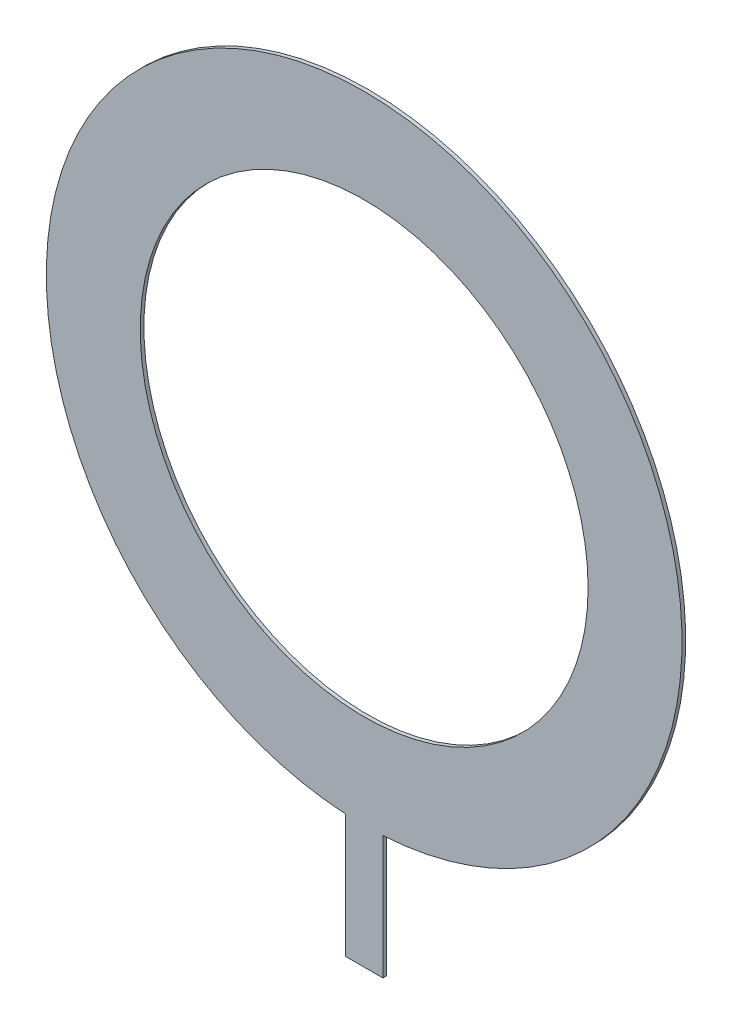
from build123d import *

# Parameters (mm, degrees)
BOSS_EXTRUDE1_DEPTH = 0.127


with BuildPart() as part:
    # Sketch1 → Boss-Extrude1 (new body)
    # profile 1 of 5: a face of its own
    with BuildSketch(Plane.XY):
        with BuildLine():
            Line((-0.65, -7.75), (0, -7.75))
            Line((0, -7.75), (0.65, -7.75))
            Line((0.65, -7.75), (0.65, -10.980778661))
            ThreePointArc((0.65, -10.980778661), (8.004686128, -7.544865804), (11, 0))
            ThreePointArc((11, 0), (-7.544865804, 8.004686128), (-0.65, -10.980778661))
            Line((-0.65, -10.980778661), (-0.65, -7.75))
        make_face()
        with BuildLine():
            ThreePointArc((7.75, 0), (5.480077554, -5.480077554), (0, -7.75))
            ThreePointArc((0, -7.75), (-5.480077554, 5.480077554), (7.75, 0))
        make_face(mode=Mode.SUBTRACT)
    # profile 2 of 5: a face of its own
    with BuildSketch(Plane.XY):
        with BuildLine():
            Line((0.65, -7.75), (0, -7.75))
            Line((0, -7.75), (0, -11))
            ThreePointArc((0, -11), (0.325142069, -10.995193615), (0.65, -10.980778661))
            Line((0.65, -10.980778661), (0.65, -7.75))
        make_face()
    # profile 3 of 5: a face of its own
    with BuildSketch(Plane.XY):
        with BuildLine():
            Line((0, -11), (0, -7.75))
            Line((0, -7.75), (-0.65, -7.75))
            Line((-0.65, -7.75), (-0.65, -10.980778661))
            ThreePointArc((-0.65, -10.980778661), (-0.325142069, -10.995193615), (0, -11))
        make_face()
    # profile 4 of 5: a face of its own
    with BuildSketch(Plane.XY):
        with BuildLine():
            Line((0, -15.25), (0, -11))
            ThreePointArc((0, -11), (-0.325142069, -10.995193615), (-0.65, -10.980778661))
            Line((-0.65, -10.980778661), (-0.65, -15.25))
            Line((-0.65, -15.25), (0, -15.25))
        make_face()
    # profile 5 of 5: a face of its own
    with BuildSketch(Plane.XY):
        with BuildLine():
            ThreePointArc((0.65, -10.980778661), (0.325142069, -10.995193615), (0, -11))
            Line((0, -11), (0, -15.25))
            Line((0, -15.25), (0.65, -15.25))
            Line((0.65, -15.25), (0.65, -10.980778661))
        make_face()
    extrude(amount=BOSS_EXTRUDE1_DEPTH)


solid = part.part
